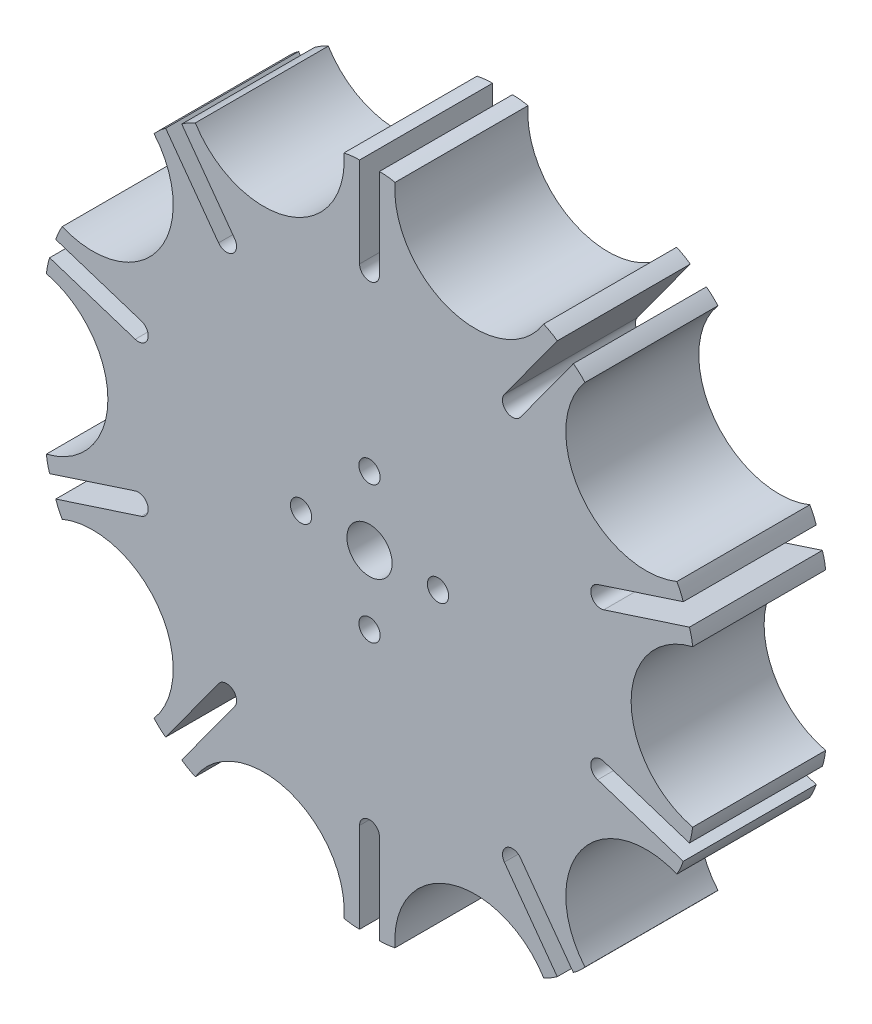
from build123d import *

# Parameters (mm, degrees)
BOSS_EXTRUDE1_DEPTH = 50.8
SKETCH2_R           = 8.636
SKETCH2_R_2         = 4.064
CUT_EXTRUDE1_DEPTH  = 50.8
CIRPATTERN1_COUNT   = 4


with BuildPart() as part:
    # Sketch1 → Boss-Extrude1 (new body)
    with BuildSketch(Plane.XY):
        with BuildLine():
            Line((-3.797752579, 127.26397791), (-3.797752579, 92.878939343))
            ThreePointArc((-3.797752579, 92.878939343), (0, 89.081186764), (3.797752579, 92.878939343))
            Line((3.797752579, 92.878939343), (3.797752579, 127.26397791))
            ThreePointArc((3.797752579, 127.26397791), (6.790630722, 127.103835386), (9.749331178, 126.62523659))
            ThreePointArc((9.749331178, 126.62523659), (30.88440355, 95.052420362), (66.541072029, 108.172481405))
            ThreePointArc((66.541072029, 108.172481405), (69.216024294, 106.82059547), (71.731442986, 105.190983859))
            Line((71.731442986, 105.190983859), (51.520424417, 77.372903306))
            ThreePointArc((51.520424417, 77.372903306), (52.360607836, 72.068193971), (57.665317172, 72.90837739))
            Line((57.665317172, 72.90837739), (77.876335741, 100.726457943))
            ThreePointArc((77.876335741, 100.726457943), (80.203495606, 98.837730286), (82.315821243, 96.711455232))
            ThreePointArc((82.315821243, 96.711455232), (80.856418217, 58.745626497), (117.415047369, 48.40151497))
            ThreePointArc((117.415047369, 48.40151497), (118.784510595, 45.735518782), (119.861665394, 42.938609284))
            Line((119.861665394, 42.938609284), (87.159550401, 32.313048015))
            ThreePointArc((87.159550401, 32.313048015), (84.721243151, 27.527600589), (89.506690576, 25.089293339))
            Line((89.506690576, 25.089293339), (122.208805569, 35.714854608))
            ThreePointArc((122.208805569, 35.714854608), (122.981351186, 32.818971587), (123.440465405, 29.857185076))
            ThreePointArc((123.440465405, 29.857185076), (99.944029333, 0), (123.440465405, -29.857185076))
            ThreePointArc((123.440465405, -29.857185076), (122.981351186, -32.818971587), (122.208805569, -35.714854608))
            Line((122.208805569, -35.714854608), (89.506690576, -25.089293339))
            ThreePointArc((89.506690576, -25.089293339), (84.721243151, -27.527600589), (87.159550401, -32.313048015))
            Line((87.159550401, -32.313048015), (119.861665394, -42.938609284))
            ThreePointArc((119.861665394, -42.938609284), (118.784510595, -45.735518782), (117.415047369, -48.40151497))
            ThreePointArc((117.415047369, -48.40151497), (80.856418217, -58.745626497), (82.315821243, -96.711455232))
            ThreePointArc((82.315821243, -96.711455232), (80.203495606, -98.837730286), (77.876335741, -100.726457943))
            Line((77.876335741, -100.726457943), (57.665317172, -72.90837739))
            ThreePointArc((57.665317172, -72.90837739), (52.360607836, -72.068193971), (51.520424417, -77.372903306))
            Line((51.520424417, -77.372903306), (71.731442986, -105.190983859))
            ThreePointArc((71.731442986, -105.190983859), (69.216024294, -106.82059547), (66.541072029, -108.172481405))
            ThreePointArc((66.541072029, -108.172481405), (30.88440355, -95.052420362), (9.749331178, -126.62523659))
            ThreePointArc((9.749331178, -126.62523659), (6.790630722, -127.103835386), (3.797752579, -127.26397791))
            Line((3.797752579, -127.26397791), (3.797752579, -92.878939343))
            ThreePointArc((3.797752579, -92.878939343), (0, -89.081186764), (-3.797752579, -92.878939343))
            Line((-3.797752579, -92.878939343), (-3.797752579, -127.26397791))
            ThreePointArc((-3.797752579, -127.26397791), (-6.790630722, -127.103835386), (-9.749331178, -126.62523659))
            ThreePointArc((-9.749331178, -126.62523659), (-30.88440355, -95.052420362), (-66.541072029, -108.172481405))
            ThreePointArc((-66.541072029, -108.172481405), (-69.216024294, -106.82059547), (-71.731442986, -105.190983859))
            Line((-71.731442986, -105.190983859), (-51.520424417, -77.372903306))
            ThreePointArc((-51.520424417, -77.372903306), (-52.360607836, -72.068193971), (-57.665317172, -72.90837739))
            Line((-57.665317172, -72.90837739), (-77.876335741, -100.726457943))
            ThreePointArc((-77.876335741, -100.726457943), (-80.203495606, -98.837730286), (-82.315821243, -96.711455232))
            ThreePointArc((-82.315821243, -96.711455232), (-80.856418217, -58.745626497), (-117.415047369, -48.40151497))
            ThreePointArc((-117.415047369, -48.40151497), (-118.784510595, -45.735518782), (-119.861665394, -42.938609284))
            Line((-119.861665394, -42.938609284), (-87.159550401, -32.313048015))
            ThreePointArc((-87.159550401, -32.313048015), (-84.721243151, -27.527600589), (-89.506690576, -25.089293339))
            Line((-89.506690576, -25.089293339), (-122.208805569, -35.714854608))
            ThreePointArc((-122.208805569, -35.714854608), (-122.981351186, -32.818971587), (-123.440465405, -29.857185076))
            ThreePointArc((-123.440465405, -29.857185076), (-99.944029333, 0), (-123.440465405, 29.857185076))
            ThreePointArc((-123.440465405, 29.857185076), (-122.981351186, 32.818971587), (-122.208805569, 35.714854608))
            Line((-122.208805569, 35.714854608), (-89.506690576, 25.089293339))
            ThreePointArc((-89.506690576, 25.089293339), (-84.721243151, 27.527600589), (-87.159550401, 32.313048015))
            Line((-87.159550401, 32.313048015), (-119.861665394, 42.938609284))
            ThreePointArc((-119.861665394, 42.938609284), (-118.784510595, 45.735518782), (-117.415047369, 48.40151497))
            ThreePointArc((-117.415047369, 48.40151497), (-80.856418217, 58.745626497), (-82.315821243, 96.711455232))
            ThreePointArc((-82.315821243, 96.711455232), (-80.203495606, 98.837730286), (-77.876335741, 100.726457943))
            Line((-77.876335741, 100.726457943), (-57.665317172, 72.90837739))
            ThreePointArc((-57.665317172, 72.90837739), (-52.360607836, 72.068193971), (-51.520424417, 77.372903306))
            Line((-51.520424417, 77.372903306), (-71.731442986, 105.190983859))
            ThreePointArc((-71.731442986, 105.190983859), (-69.216024294, 106.82059547), (-66.541072029, 108.172481405))
            ThreePointArc((-66.541072029, 108.172481405), (-30.88440355, 95.052420362), (-9.749331178, 126.62523659))
            ThreePointArc((-9.749331178, 126.62523659), (-6.790630722, 127.103835386), (-3.797752579, 127.26397791))
        make_face()
    extrude(amount=BOSS_EXTRUDE1_DEPTH)

    # Sketch2 → Cut-Extrude1 (cut)
    with BuildSketch(Plane(origin=(0, 0, 0), x_dir=(-1, 0, 0), z_dir=(0, 0, -1))):
        Circle(SKETCH2_R)
        with Locations((0, 26.162)):
            Circle(SKETCH2_R_2)
    cut_extrude1 = extrude(amount=-CUT_EXTRUDE1_DEPTH, mode=Mode.SUBTRACT)

    # CirPattern1: Cut-Extrude1 ×4 about axis
    cirpattern1_axis = Axis((0, 0, 50.8), (0, 0, -1))
    for i in range(1, CIRPATTERN1_COUNT):
        add(cut_extrude1.rotate(cirpattern1_axis, i * 360 / CIRPATTERN1_COUNT), mode=Mode.SUBTRACT)


solid = part.part
